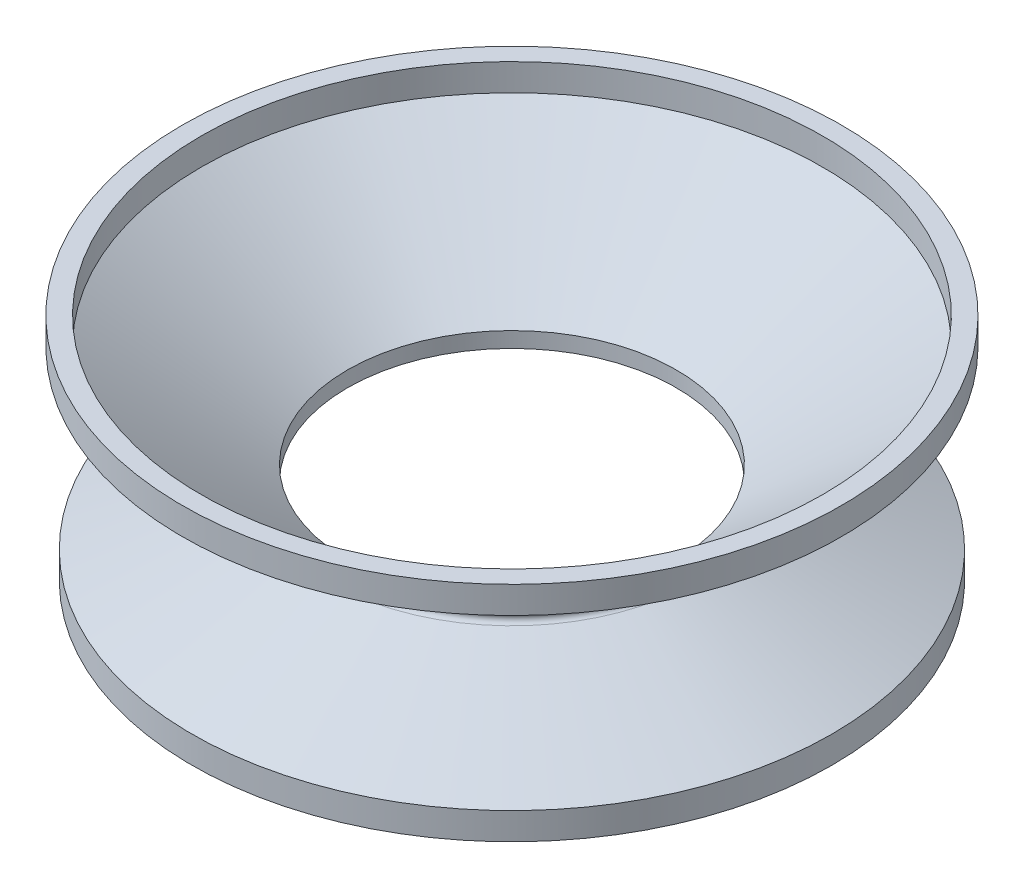
from build123d import *

# Parameters (mm, degrees)
FILLET2_R           = 0.4
SKETCH2_R           = 24.394757436
SKETCH2_R_2         = 23
BOSS_EXTRUDE1_DEPTH = 2
SKETCH3_R           = 23.692107985
SKETCH3_R_2         = 21.325906402
BOSS_EXTRUDE2_DEPTH = 2


with BuildPart() as part:
    # Sketch1 → Revolve1 (revolve)
    with BuildSketch(Plane.XY):
        Polygon((0.662781953, 0), (-10.762402101, 8), (-9.367644665, 8), (1.462781953, 0.41645364), (1.462781953, -0.730331792), (-7.693551067, -5), (-10.05975265, -5), align=None)
    revolve(axis=Axis((13.632355335, 7.609018033, 0), (0, -1, 0)))

    # Fillet2
    fillet2_edges = [part.edges().sort_by_distance(p)[0] for p in [
        (26.601928718, 0, 0),
    ]]
    fillet(fillet2_edges, radius=FILLET2_R)

    # Sketch2 → Boss-Extrude1 (add)
    with BuildSketch(Plane(origin=(0, 8, 0), x_dir=(1, 0, 0), z_dir=(0, 1, 0))):
        with Locations(Location((13.632355335, 0, 0), (0, 0, 180))):
            Circle(SKETCH2_R)
        with Locations(Location((13.632355335, 0, 0), (0, 0, 180))):
            Circle(SKETCH2_R_2, mode=Mode.SUBTRACT)
    extrude(amount=BOSS_EXTRUDE1_DEPTH)

    # Sketch3 → Boss-Extrude2 (add)
    with BuildSketch(Plane.XZ.offset(5)):
        with Locations((13.632355335, 0)):
            Circle(SKETCH3_R)
        with Locations(Location((13.632355335, 0, 0), (0, 0, 180))):
            Circle(SKETCH3_R_2, mode=Mode.SUBTRACT)
    extrude(amount=BOSS_EXTRUDE2_DEPTH)


solid = part.part
